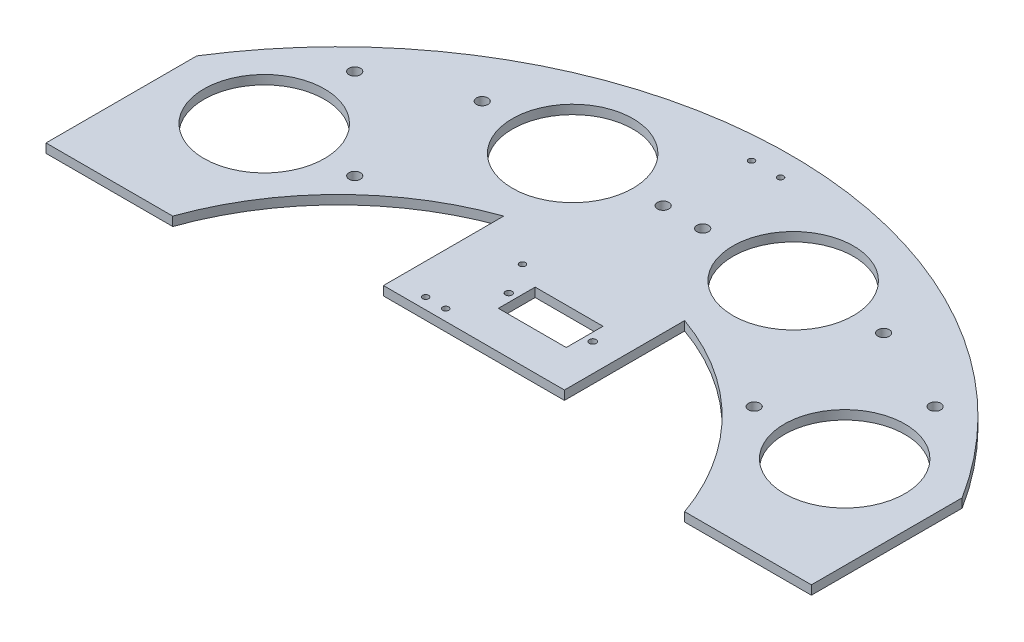
from build123d import *

# Parameters (mm, degrees)
SKETCH3_R              = 20
BOSS_EXTRUDE3_DEPTH    = 3
F_10_24_TAPPED_HOLE1_D = 3.7973
SKETCH6_W              = 22.5
SKETCH6_H              = 12.2
CUT_EXTRUDE1_DEPTH     = 3
SKETCH7_R              = 1
SKETCH7_R_2            = 1.1
SKETCH7_R_3            = 1.122553576
CUT_EXTRUDE2_DEPTH     = 164.588932015


with BuildPart() as part:
    # Sketch3 → Boss-Extrude3 (new body)
    with BuildSketch(Plane(origin=(0, 0, 0), x_dir=(1, 0, 0), z_dir=(0, 1, 0))):
        with BuildLine():
            Line((-126.885775404, 33.210167511), (-126.885775404, -16.789832489))
            Line((-126.885775404, -16.789832489), (-84.87168845, -16.789832489))
            ThreePointArc((-84.87168845, -16.789832489), (-63.652193601, 16.862361112), (-30, 38.081855961))
            Line((-30, 38.081855961), (-30, -1.789832489))
            Line((-30, -1.789832489), (30, -1.789832489))
            Line((30, -1.789832489), (30, 38.081855961))
            ThreePointArc((30, 38.081855961), (63.652193601, 16.862361112), (84.87168845, -16.789832489))
            Line((84.87168845, -16.789832489), (126.885775404, -16.789832489))
            Line((126.885775404, -16.789832489), (126.885775404, 33.210167511))
            ThreePointArc((126.885775404, 33.210167511), (0, 103.210167511), (-126.885775404, 33.210167511))
        make_face()
        with Locations(Location((-96.223855306, 24.910723088, 0), (0, 0, 270))):
            Circle(SKETCH3_R, mode=Mode.SUBTRACT)
        with Locations(Location((96.223855306, 24.910723088, 0), (0, 0, 270))):
            Circle(SKETCH3_R, mode=Mode.SUBTRACT)
        with Locations(Location((-36.555626875, 67.506651026, 0), (0, 0, 270))):
            Circle(SKETCH3_R, mode=Mode.SUBTRACT)
        with Locations(Location((36.555626875, 67.506651026, 0), (0, 0, 270))):
            Circle(SKETCH3_R, mode=Mode.SUBTRACT)
    extrude(amount=BOSS_EXTRUDE3_DEPTH)

    # #10-24 Tapped Hole1 (through all)
    with Locations(Plane(origin=(0, 3, 0), x_dir=(1, 0, 0), z_dir=(0, 1, 0))):
        with Locations((-66.223855306, 24.910723088), (-96.223855306, 54.910723088), (-66.555626875, 67.506651026), (-6.555626875, 67.506651026), (6.555626875, 67.506651026), (66.555626875, 67.506651026), (96.223855306, 54.910723088), (66.223855306, 24.910723088)):
            Hole(F_10_24_TAPPED_HOLE1_D / 2)

    # Sketch6 → Cut-Extrude1 (cut)
    with BuildSketch(Plane.XZ):
        with Locations((6.85, -16.810167511)):
            Rectangle(SKETCH6_W, SKETCH6_H)
    extrude(amount=-CUT_EXTRUDE1_DEPTH, mode=Mode.SUBTRACT)

    # Sketch7 → Cut-Extrude2 (cut, through all)
    with BuildSketch(Plane.XZ):
        with Locations(Location((-13.053692885, -1.910723088, 0), (0, 0, 270))):
            Circle(SKETCH7_R)
        with Locations(Location((-19.702079803, -1.910723088, 0), (0, 0, 270))):
            Circle(SKETCH7_R)
        with Locations(Location((-13.053692885, -27.360397158, 0), (0, 0, 270))):
            Circle(SKETCH7_R)
        with Locations(Location((-4.804956753, -95.064096736, 0), (0, 0, 270))):
            Circle(SKETCH7_R)
        with Locations(Location((4.804956753, -95.064096736, 0), (0, 0, 270))):
            Circle(SKETCH7_R)
        with Locations(Location((-7.05, -16.810167511, 0), (0, 0, 270))):
            Circle(SKETCH7_R_2)
        with Locations(Location((20.754736903, -16.832218034, 0), (0, 0, 270))):
            Circle(SKETCH7_R_3)
    extrude(amount=-CUT_EXTRUDE2_DEPTH, mode=Mode.SUBTRACT)


solid = part.part
